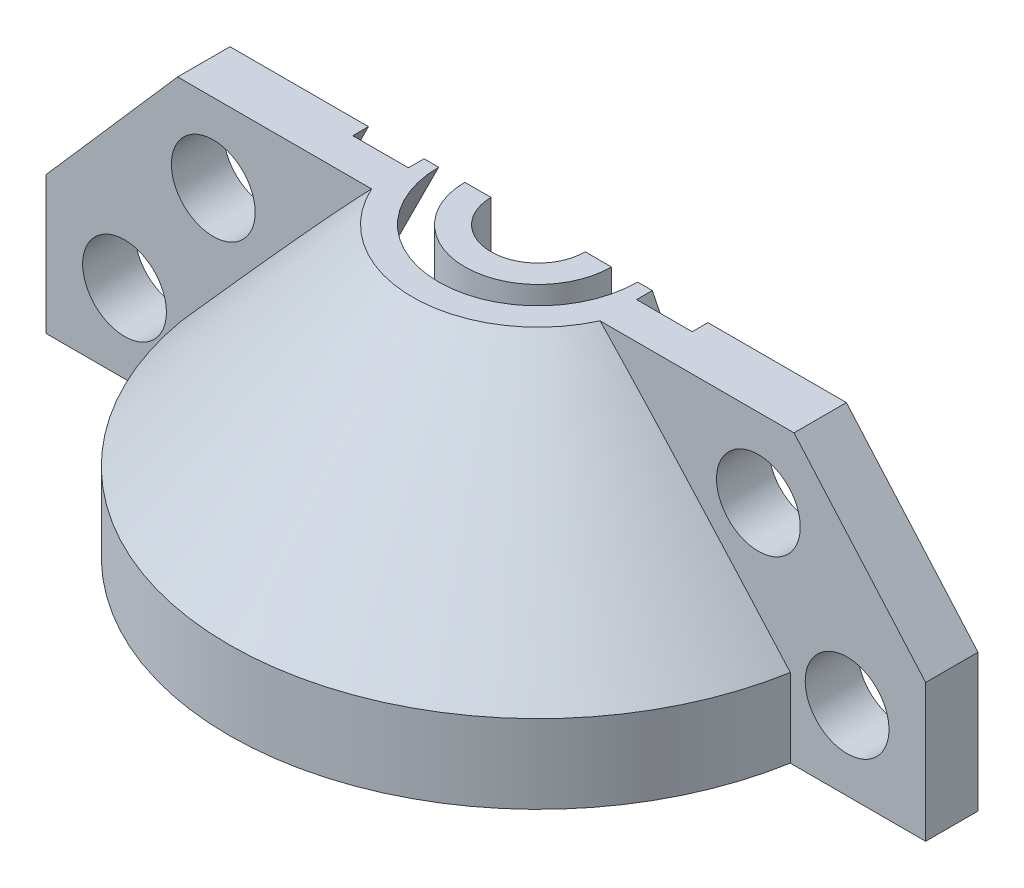
from build123d import *

# Parameters (mm, degrees)
SKETCH1_W             = 1
SKETCH1_H             = 8
REVOLVE1_ANGLE        = 180
SKETCH2_R             = 1.6
BOSS_EXTRUDE1_DEPTH   = 2
BOSS_EXTRUDE1_2_DEPTH = 2
REVOLVE2_ANGLE        = 180
CUT_EXTRUDE1_DEPTH    = 0.6


with BuildPart() as part:
    # Sketch1 → Revolve1 (revolve)
    with BuildSketch(Plane.XY):
        Polygon((-1.8, -3), (-1.8, 0), (-2.8, 0), (-7.8, 0), (-10.8, 0), (-10.8, -3), align=None)
        Polygon((-10.8, 0), (-3.8, 8), (-7.8, 0), align=None)
        with Locations((-2.3, 4)):
            Rectangle(SKETCH1_W, SKETCH1_H)
    revolve(axis=Axis((0, 0, 0), (0, 1, 0)), revolution_arc=REVOLVE1_ANGLE)



with BuildPart() as body_2:
    # Sketch2 → Boss-Extrude1 (new body)
    with BuildSketch(Plane(origin=(0, 0, 0), x_dir=(-1, 0, 0), z_dir=(0, 0, -1))):
        Polygon((-10.8, -3), (-16.8, -3), (-16.8, 2.254410697), (-11.77260936, 8), (-3.8, 8), (-10.8, 0), align=None)
        with Locations((-10.41130468, 5)):
            Circle(SKETCH2_R, mode=Mode.SUBTRACT)
        with Locations((-13.8, 0)):
            Circle(SKETCH2_R, mode=Mode.SUBTRACT)
    extrude(amount=-BOSS_EXTRUDE1_DEPTH)


with BuildPart() as body_3:
    # Sketch2 → Boss-Extrude1 2 (new body)
    with BuildSketch(Plane(origin=(0, 0, 0), x_dir=(-1, 0, 0), z_dir=(0, 0, -1))):
        Polygon((10.8, 0), (3.8, 8), (11.77260936, 8), (16.8, 2.254410697), (16.8, -3), (10.8, -3), align=None)
        with Locations(Location((13.8, 0, 0), (0, 0, 180))):
            Circle(SKETCH2_R, mode=Mode.SUBTRACT)
        with Locations(Location((10.41130468, 5, 0), (0, 0, 180))):
            Circle(SKETCH2_R, mode=Mode.SUBTRACT)
    extrude(amount=-BOSS_EXTRUDE1_2_DEPTH)


with BuildPart() as part_1:
    add(part.part)

    add(body_2.part)  # Revolve2 merges body 2

    add(body_3.part)  # Revolve2 merges body 3
    # Sketch3 → Revolve2 (revolve)
    with BuildSketch(Plane(origin=(0, 0, 0), x_dir=(-1, 0, 0), z_dir=(0, 0, -1))):
        Polygon((-11.8, -3), (-11.8, 0), (-4.8, 8), (-3.8, 8), (-10.8, 0), (-10.8, -3), align=None)
    revolve(axis=Axis((0, 0, 0), (0, -1, 0)), revolution_arc=REVOLVE2_ANGLE)

    # Sketch4 → Cut-Extrude1 (cut)
    with BuildSketch(Plane(origin=(0, 0, 0), x_dir=(-1, 0, 0), z_dir=(0, 0, -1))):
        Polygon((-6.483281573, 8), (-11.683281573, -2.4), (-2.4, -2.4), (-2.4, -0.5), (-8.609016994, -0.5), (-4.359016994, 8), align=None)
        Polygon((2.4, -2.4), (11.683281573, -2.4), (6.383281573, 8.2), (4.259016994, 8.2), (8.609016994, -0.5), (2.4, -0.5), align=None)
    extrude(amount=-CUT_EXTRUDE1_DEPTH, mode=Mode.SUBTRACT)


solid = part_1.part
